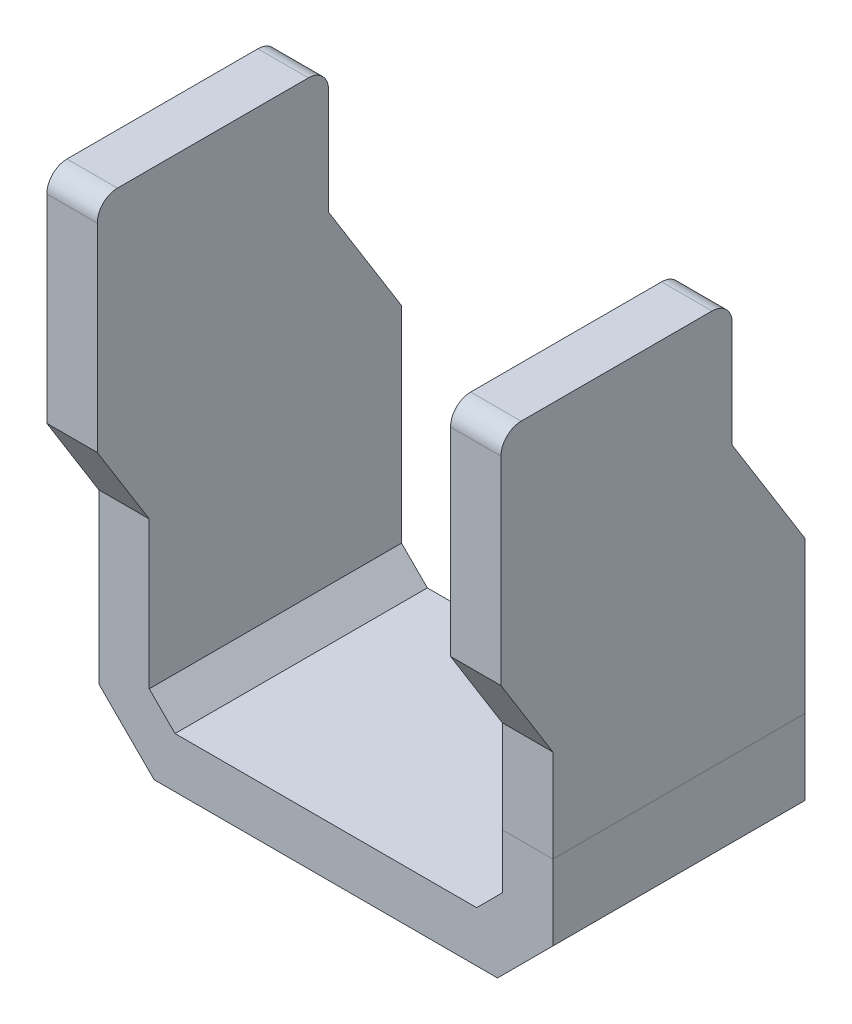
from build123d import *

# Parameters (mm, degrees)
BOSS_EXTRUDE1_DEPTH = 25
BOSS_EXTRUDE3_DEPTH = 5


with BuildPart() as part:
    # Sketch1 → Boss-Extrude1 (new body)
    with BuildSketch(Plane.XY):
        Polygon((-17.5, 7.949579473), (-17.5, 2.559294279), (-14.940705721, 0), (0, 0), (14.940705721, 0), (17.5, 2.559294279), (17.5, 7.949579473), (22.5, 7.949579473), (22.5, 0.488226467), (17.011773533, -5), (0, -5), (-17.011773533, -5), (-22.5, 0.488226467), (-22.5, 7.949579473), align=None)
    extrude(amount=BOSS_EXTRUDE1_DEPTH)


with BuildPart() as body_2:
    # Sketch3 → Boss-Extrude3 (new body)
    with BuildSketch(Plane(origin=(22.5, 0, 0), x_dir=(0, 0, -1), z_dir=(1, 0, 0))):
        with BuildLine():
            Line((-25, 7.949579473), (0, 7.949579473))
            Line((0, 7.949579473), (0, 22.949579473))
            Line((0, 22.949579473), (-7.230778036, 34.577519471))
            Line((-7.230778036, 34.577519471), (-7.230778036, 45.099433505))
            ThreePointArc((-7.230778036, 45.099433505), (-7.816564474, 46.513647067), (-9.230778036, 47.099433505))
            Line((-9.230778036, 47.099433505), (-28.148577305, 47.099433505))
            ThreePointArc((-28.148577305, 47.099433505), (-29.562790867, 46.513647067), (-30.148577305, 45.099433505))
            Line((-30.148577305, 45.099433505), (-30.148577305, 25.416180597))
            Line((-30.148577305, 25.416180597), (-25, 17.136663832))
            Line((-25, 17.136663832), (-25, 7.949579473))
        make_face()
    boss_extrude3 = extrude(amount=-BOSS_EXTRUDE3_DEPTH)


with BuildPart() as part_1:
    add(part.part)

    # Mirror5: Boss-Extrude3 across plane
    add(boss_extrude3.mirror(Plane.ZY))


solid = Compound([body_2.part, part_1.part])
